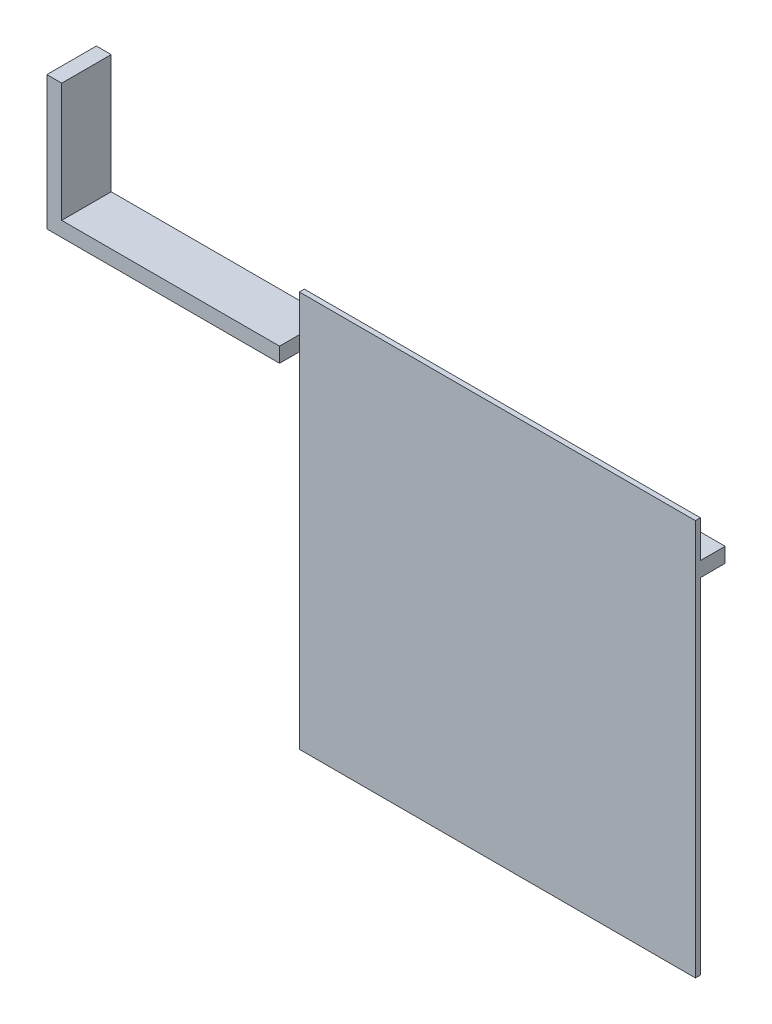
from build123d import *

# Parameters (mm, degrees)
BOSS_EXTRUDE1_DEPTH = 10
SKETCH4_W           = 80
SKETCH4_H           = 5
CUT_EXTRUDE1_DEPTH  = 6
SKETCH5_W           = 80
SKETCH5_H           = 80
BOSS_EXTRUDE3_DEPTH = 1


with BuildPart() as part:
    # Sketch1 → Boss-Extrude1 (new body)
    with BuildSketch(Plane.XY):
        Polygon((0, 0), (0, -27), (127, -27), (127, -24), (3, -24), (3, 0), align=None)
    extrude(amount=BOSS_EXTRUDE1_DEPTH)

    # Sketch4 → Cut-Extrude1 (cut)
    with BuildSketch(Plane(origin=(0, -24, 0), x_dir=(1, 0, 0), z_dir=(0, 1, 0))):
        with Locations((87, -7.5)):
            Rectangle(SKETCH4_W, SKETCH4_H)
    extrude(amount=-CUT_EXTRUDE1_DEPTH, mode=Mode.SUBTRACT)

    # Sketch5 → Boss-Extrude3 (add)
    with BuildSketch(Plane.XY.offset(5)):
        with Locations((87, -56.52)):
            Rectangle(SKETCH5_W, SKETCH5_H)
    extrude(amount=BOSS_EXTRUDE3_DEPTH)


solid = part.part
